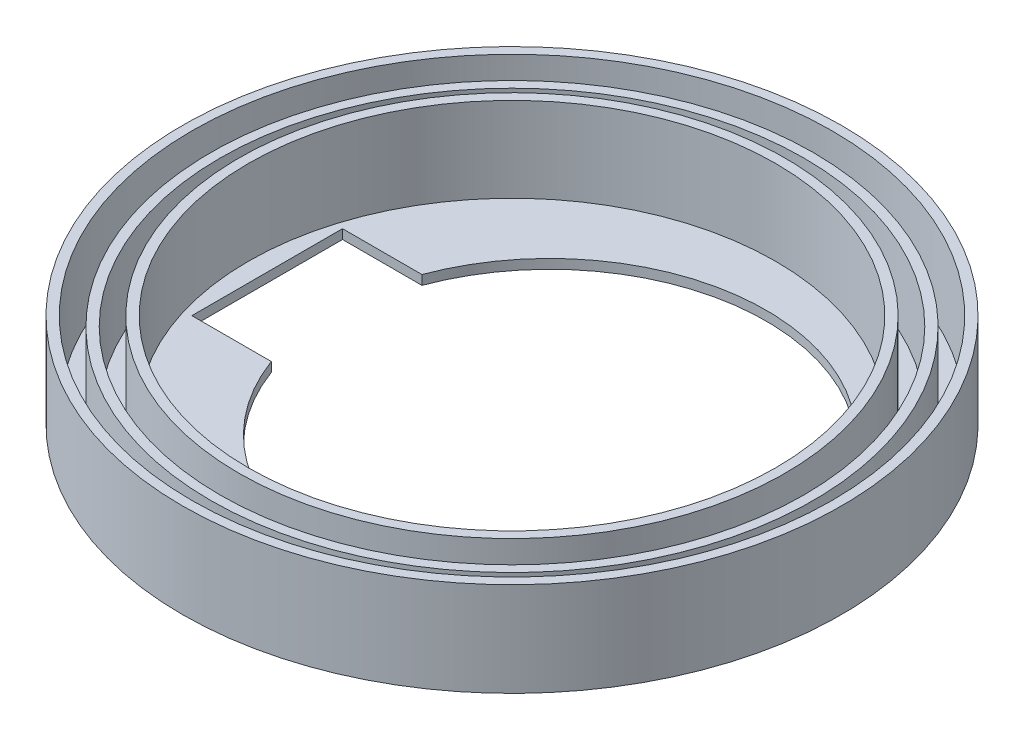
from build123d import *

# Parameters (mm, degrees)
SKETCH1_R           = 17.5
BOSS_EXTRUDE1_DEPTH = 0.5
SKETCH2_R           = 11.5
CUT_EXTRUDE1_DEPTH  = 0.5
SKETCH3_W           = 15
SKETCH3_H           = 8
CUT_EXTRUDE4_DEPTH  = 2.5
SKETCH4_R           = 16
SKETCH4_R_2         = 15.5
BOSS_EXTRUDE2_DEPTH = 4.5
SKETCH5_R           = 14.5
SKETCH5_R_2         = 14
BOSS_EXTRUDE3_DEPTH = 4.5
SKETCH6_R           = 17.5
SKETCH6_R_2         = 17
BOSS_EXTRUDE4_DEPTH = 4.5


with BuildPart() as part:
    # Sketch1 → Boss-Extrude1 (new body)
    with BuildSketch(Plane(origin=(0, 0, 0), x_dir=(1, 0, 0), z_dir=(0, 1, 0))):
        with Locations(Location((0, 0, 0), (0, 0, 270))):
            Circle(SKETCH1_R)
    extrude(amount=BOSS_EXTRUDE1_DEPTH)

    # Sketch2 → Cut-Extrude1 (cut)
    with BuildSketch(Plane(origin=(0, 0.5, 0), x_dir=(1, 0, 0), z_dir=(0, 1, 0))):
        with Locations(Location((2, 0, 0), (0, 0, 270))):
            Circle(SKETCH2_R)
    extrude(amount=-CUT_EXTRUDE1_DEPTH, mode=Mode.SUBTRACT)

    # Sketch3 → Cut-Extrude4 (cut)
    with BuildSketch(Plane(origin=(0, 0, 0), x_dir=(1, 0, 0), z_dir=(0, 1, 0))):
        with Locations((-5.5, 0)):
            Rectangle(SKETCH3_W, SKETCH3_H)
    extrude(amount=CUT_EXTRUDE4_DEPTH, mode=Mode.SUBTRACT)

    # Sketch4 → Boss-Extrude2 (add)
    with BuildSketch(Plane(origin=(0, 0, 0), x_dir=(1, 0, 0), z_dir=(0, 1, 0))):
        with Locations(Location((0, 0, 0), (0, 0, 270))):
            Circle(SKETCH4_R)
        with Locations(Location((0, 0, 0), (0, 0, 270))):
            Circle(SKETCH4_R_2, mode=Mode.SUBTRACT)
    extrude(amount=BOSS_EXTRUDE2_DEPTH)

    # Sketch5 → Boss-Extrude3 (add)
    with BuildSketch(Plane(origin=(0, 0.5, 0), x_dir=(1, 0, 0), z_dir=(0, 1, 0))):
        with Locations(Location((0, 0, 0), (0, 0, 270))):
            Circle(SKETCH5_R)
        with Locations(Location((0, 0, 0), (0, 0, 270))):
            Circle(SKETCH5_R_2, mode=Mode.SUBTRACT)
    extrude(amount=BOSS_EXTRUDE3_DEPTH)

    # Sketch6 → Boss-Extrude4 (add)
    with BuildSketch(Plane(origin=(0, 0.5, 0), x_dir=(1, 0, 0), z_dir=(0, 1, 0))):
        with Locations(Location((0, 0, 0), (0, 0, 270))):
            Circle(SKETCH6_R)
        with Locations(Location((0, 0, 0), (0, 0, 270))):
            Circle(SKETCH6_R_2, mode=Mode.SUBTRACT)
    extrude(amount=BOSS_EXTRUDE4_DEPTH)


solid = part.part
